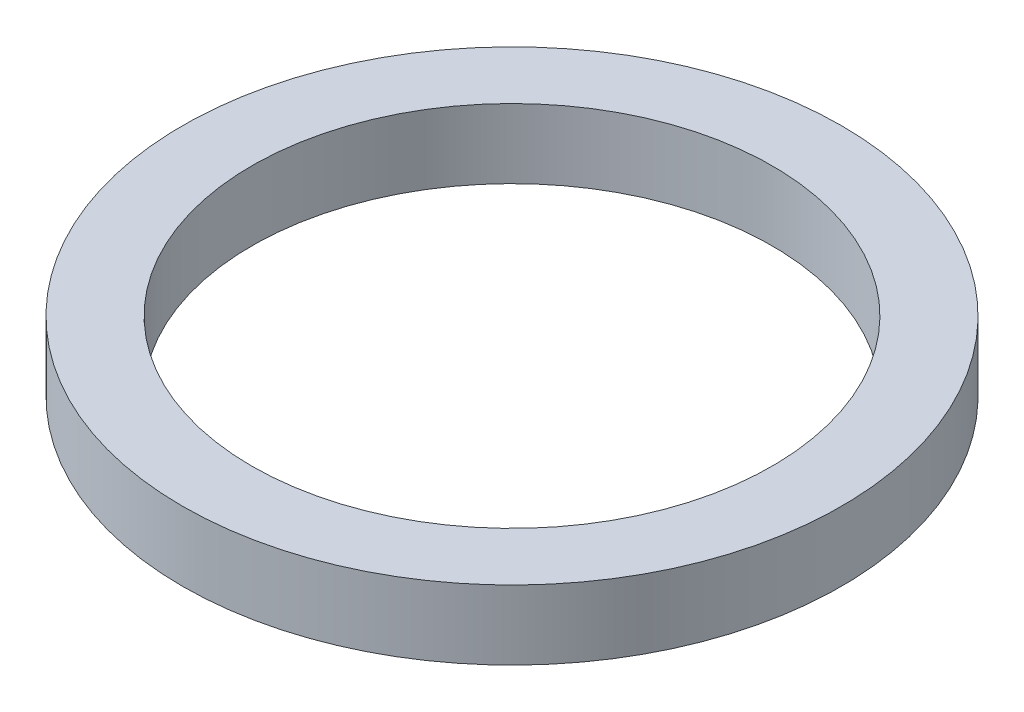
from build123d import *

# Parameters (mm, degrees)
SKETCH_1_R      = 47.5
SKETCH_1_R_2    = 37.5
EXTRUDE_1_DEPTH = 10


with BuildPart() as part:
    # 草图1 → 凸台-拉伸1 (new body)
    with BuildSketch(Plane(origin=(0, 0, 0), x_dir=(1, 0, 0), z_dir=(0, 1, 0))):
        with Locations(Location((0, 0, 0), (0, 0, 270))):
            Circle(SKETCH_1_R)
        with Locations(Location((0, 0, 0), (0, 0, 270))):
            Circle(SKETCH_1_R_2, mode=Mode.SUBTRACT)
    extrude(amount=EXTRUDE_1_DEPTH)


solid = part.part
